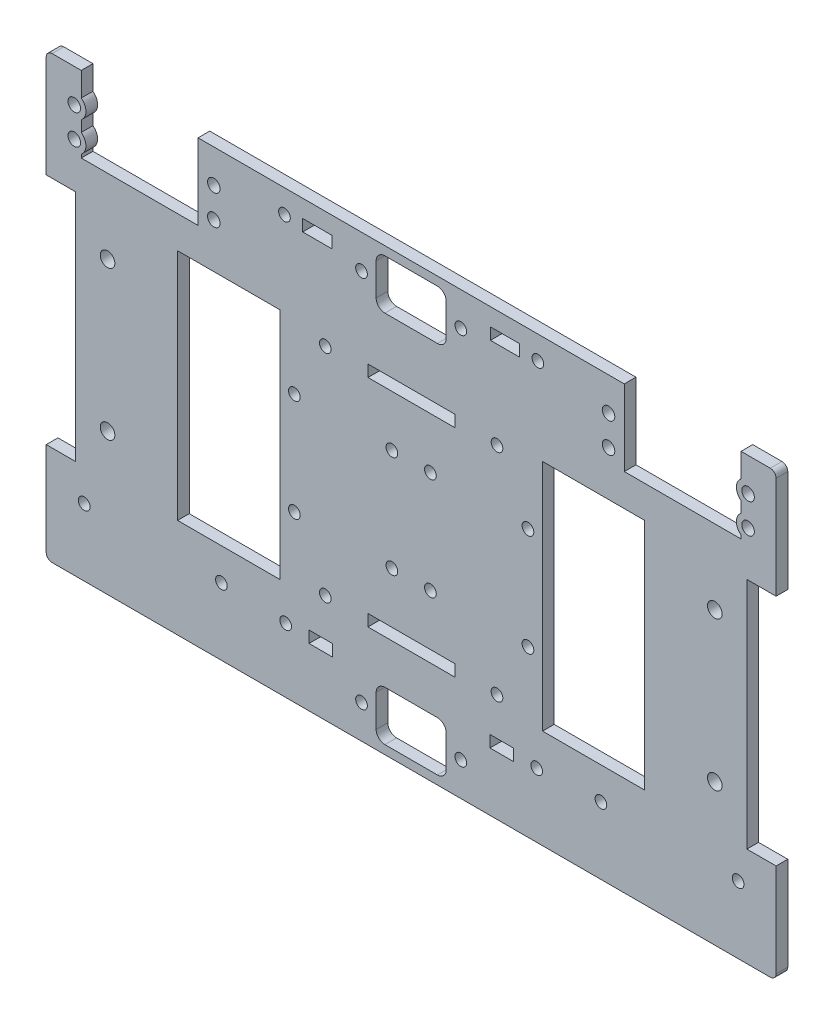
from build123d import *

# Parameters (mm, degrees)
BOSS_EXTRUDE1_DEPTH = 4
SKETCH2_R           = 2
SKETCH2_W           = 10
SKETCH2_H           = 80
SKETCH2_W_2         = 35
SKETCH2_H_2         = 80.000000001
CUT_EXTRUDE1_DEPTH  = 10
SKETCH6_R           = 2.5
CUT_EXTRUDE5_DEPTH  = 10
SKETCH11_R          = 2
CUT_EXTRUDE9_DEPTH  = 10
SKETCH16_W          = 40
SKETCH16_H          = 26
CUT_EXTRUDE10_DEPTH = 10
SKETCH17_R          = 2.15
CUT_EXTRUDE11_DEPTH = 10
SKETCH26_R          = 2
CUT_EXTRUDE18_DEPTH = 10
SKETCH28_R          = 4
SKETCH28_R_2        = 2.15
BOSS_EXTRUDE2_DEPTH = 4
SKETCH29_W          = 8
SKETCH29_H          = 4
SKETCH29_W_2        = 29.8
SKETCH29_W_3        = 10
CUT_EXTRUDE19_DEPTH = 10
SKETCH30_R          = 2
CUT_EXTRUDE20_DEPTH = 10


with BuildPart() as part:
    # Sketch1 → Boss-Extrude1 (new body)
    with BuildSketch(Plane.XY):
        with BuildLine():
            Line((-123, 77), (123, 77))
            ThreePointArc((123, 77), (124.414213562, 76.414213562), (125, 75))
            Line((125, 75), (125, -72))
            ThreePointArc((125, -72), (124.414213562, -73.414213562), (123, -74))
            Line((123, -74), (-123, -74))
            ThreePointArc((-123, -74), (-124.414213562, -73.414213562), (-125, -72))
            Line((-125, -72), (-125, 75))
            ThreePointArc((-125, 75), (-124.414213562, 76.414213562), (-123, 77))
        make_face()
    extrude(amount=BOSS_EXTRUDE1_DEPTH)

    # Sketch2 → Cut-Extrude1 (cut)
    with BuildSketch(Plane(origin=(0, 0, 0), x_dir=(-1, 0, 0), z_dir=(0, 0, -1))):
        with Locations((-6.6, -17.5)):
            Circle(SKETCH2_R)
        with Locations((-6.6, 17.5)):
            Circle(SKETCH2_R)
        with Locations((-40, -17.5)):
            Circle(SKETCH2_R)
        with Locations((-40, 17.5)):
            Circle(SKETCH2_R)
        with Locations((6.6, 17.5)):
            Circle(SKETCH2_R)
        with Locations((6.6, -17.5)):
            Circle(SKETCH2_R)
        with Locations((40, -17.5)):
            Circle(SKETCH2_R)
        with Locations((40, 17.5)):
            Circle(SKETCH2_R)
        with Locations((-120, 0)):
            Rectangle(SKETCH2_W, SKETCH2_H)
        with Locations((-62.5, -1e-09)):
            Rectangle(SKETCH2_W_2, SKETCH2_H_2)
        with Locations((120, 0)):
            Rectangle(SKETCH2_W, SKETCH2_H)
        with Locations((62.5, -1e-09)):
            Rectangle(SKETCH2_W_2, SKETCH2_H_2)
    extrude(amount=-CUT_EXTRUDE1_DEPTH, mode=Mode.SUBTRACT)

    # Sketch6 → Cut-Extrude5 (cut)
    with BuildSketch(Plane(origin=(0, 0, 0), x_dir=(-1, 0, 0), z_dir=(0, 0, -1))):
        with Locations((-104, -25.5)):
            Circle(SKETCH6_R)
        with Locations((-104, 25.5)):
            Circle(SKETCH6_R)
        with Locations((104, -25.5)):
            Circle(SKETCH6_R)
        with Locations((104, 25.5)):
            Circle(SKETCH6_R)
    extrude(amount=-CUT_EXTRUDE5_DEPTH, mode=Mode.SUBTRACT)

    # Sketch11 → Cut-Extrude9 (cut)
    with BuildSketch(Plane(origin=(0, 0, 0), x_dir=(-1, 0, 0), z_dir=(0, 0, -1))):
        with Locations((-17, -62.5)):
            Circle(SKETCH11_R)
        with Locations((17, -62.5)):
            Circle(SKETCH11_R)
        with Locations((-17, 65.5)):
            Circle(SKETCH11_R)
        with Locations((17, 65.5)):
            Circle(SKETCH11_R)
        with BuildLine():
            Line((-9, -54), (9, -54))
            ThreePointArc((9, -54), (11.121320344, -54.878679656), (12, -57))
            Line((12, -57), (12, -68))
            ThreePointArc((12, -68), (11.121320344, -70.121320344), (9, -71))
            Line((9, -71), (-9, -71))
            ThreePointArc((-9, -71), (-11.121320344, -70.121320344), (-12, -68))
            Line((-12, -68), (-12, -57))
            ThreePointArc((-12, -57), (-11.121320344, -54.878679656), (-9, -54))
        make_face()
        with BuildLine():
            Line((-9, 74), (9, 74))
            ThreePointArc((9, 74), (11.121320344, 73.121320344), (12, 71))
            Line((12, 71), (12, 60))
            ThreePointArc((12, 60), (11.121320344, 57.878679656), (9, 57))
            Line((9, 57), (-9, 57))
            ThreePointArc((-9, 57), (-11.121320344, 57.878679656), (-12, 60))
            Line((-12, 60), (-12, 71))
            ThreePointArc((-12, 71), (-11.121320344, 73.121320344), (-9, 74))
        make_face()
    extrude(amount=-CUT_EXTRUDE9_DEPTH, mode=Mode.SUBTRACT)

    # Sketch16 → Cut-Extrude10 (cut)
    with BuildSketch(Plane(origin=(0, 0, 0), x_dir=(-1, 0, 0), z_dir=(0, 0, -1))):
        with Locations((-93, 64)):
            Rectangle(SKETCH16_W, SKETCH16_H)
        with Locations((93, 64)):
            Rectangle(SKETCH16_W, SKETCH16_H)
    extrude(amount=-CUT_EXTRUDE10_DEPTH, mode=Mode.SUBTRACT)

    # Sketch17 → Cut-Extrude11 (cut)
    with BuildSketch(Plane(origin=(0, 0, 0), x_dir=(-1, 0, 0), z_dir=(0, 0, -1))):
        with Locations((67.6, 65.6)):
            Circle(SKETCH17_R)
        with Locations((67.6, 55.4)):
            Circle(SKETCH17_R)
        with Locations((115.4, 55.4)):
            Circle(SKETCH17_R)
        with Locations((115.4, 65.6)):
            Circle(SKETCH17_R)
        with Locations((-115.4, 65.6)):
            Circle(SKETCH17_R)
        with Locations((-115.4, 55.4)):
            Circle(SKETCH17_R)
        with Locations((-67.6, 55.4)):
            Circle(SKETCH17_R)
        with Locations((-67.6, 65.6)):
            Circle(SKETCH17_R)
    extrude(amount=-CUT_EXTRUDE11_DEPTH, mode=Mode.SUBTRACT)

    # Sketch26 → Cut-Extrude18 (cut)
    with BuildSketch(Plane(origin=(0, 0, 0), x_dir=(-1, 0, 0), z_dir=(0, 0, -1))):
        with Locations((-112, -51)):
            Circle(SKETCH26_R)
        with Locations((-65, -51)):
            Circle(SKETCH26_R)
        with Locations((65, -51)):
            Circle(SKETCH26_R)
        with Locations((112, -51)):
            Circle(SKETCH26_R)
    extrude(amount=-CUT_EXTRUDE18_DEPTH, mode=Mode.SUBTRACT)

    # Sketch28 → Boss-Extrude2 (add)
    # profile 1 of 4: a face of its own
    with BuildSketch(Plane(origin=(0, 0, 0), x_dir=(-1, 0, 0), z_dir=(0, 0, -1))):
        with Locations((-115.4, 65.6)):
            Circle(SKETCH28_R)
        with Locations((-115.4, 65.6)):
            Circle(SKETCH28_R_2, mode=Mode.SUBTRACT)
    # profile 2 of 4: a face of its own
    with BuildSketch(Plane(origin=(0, 0, 0), x_dir=(-1, 0, 0), z_dir=(0, 0, -1))):
        with Locations((-115.4, 55.4)):
            Circle(SKETCH28_R)
        with Locations((-115.4, 55.4)):
            Circle(SKETCH28_R_2, mode=Mode.SUBTRACT)
    # profile 3 of 4: a face of its own
    with BuildSketch(Plane(origin=(0, 0, 0), x_dir=(-1, 0, 0), z_dir=(0, 0, -1))):
        with Locations((115.4, 55.4)):
            Circle(SKETCH28_R)
        with Locations((115.4, 55.4)):
            Circle(SKETCH28_R_2, mode=Mode.SUBTRACT)
    # profile 4 of 4: a face of its own
    with BuildSketch(Plane(origin=(0, 0, 0), x_dir=(-1, 0, 0), z_dir=(0, 0, -1))):
        with Locations((115.4, 65.6)):
            Circle(SKETCH28_R)
        with Locations((115.4, 65.6)):
            Circle(SKETCH28_R_2, mode=Mode.SUBTRACT)
    extrude(amount=-BOSS_EXTRUDE2_DEPTH)

    # Sketch29 → Cut-Extrude19 (cut)
    with BuildSketch(Plane.XY.offset(4)):
        with Locations((-31, -52)):
            Rectangle(SKETCH29_W, SKETCH29_H)
        with Locations((31, -52)):
            Rectangle(SKETCH29_W, SKETCH29_H)
        with Locations((0.1, -37)):
            Rectangle(SKETCH29_W_2, SKETCH29_H)
        with Locations((0.1, 37)):
            Rectangle(SKETCH29_W_2, SKETCH29_H)
        with Locations((32.15, 69)):
            Rectangle(SKETCH29_W_3, SKETCH29_H)
        with Locations((-32.15, 69)):
            Rectangle(SKETCH29_W_3, SKETCH29_H)
    extrude(amount=-CUT_EXTRUDE19_DEPTH, mode=Mode.SUBTRACT)

    # Sketch30 → Cut-Extrude20 (cut)
    with BuildSketch(Plane(origin=(0, 0, 0), x_dir=(-1, 0, 0), z_dir=(0, 0, -1))):
        with Locations((43.4, 69)):
            Circle(SKETCH30_R)
        with Locations((-43.4, 69)):
            Circle(SKETCH30_R)
        with Locations((-29.39999999, 37)):
            Circle(SKETCH30_R)
        with Locations((29.39999999, 37)):
            Circle(SKETCH30_R)
        with Locations((29.39999999, -37)):
            Circle(SKETCH30_R)
        with Locations((-29.39999999, -37)):
            Circle(SKETCH30_R)
        with Locations((-43, -52)):
            Circle(SKETCH30_R)
        with Locations((43, -52)):
            Circle(SKETCH30_R)
    extrude(amount=-CUT_EXTRUDE20_DEPTH, mode=Mode.SUBTRACT)


solid = part.part
